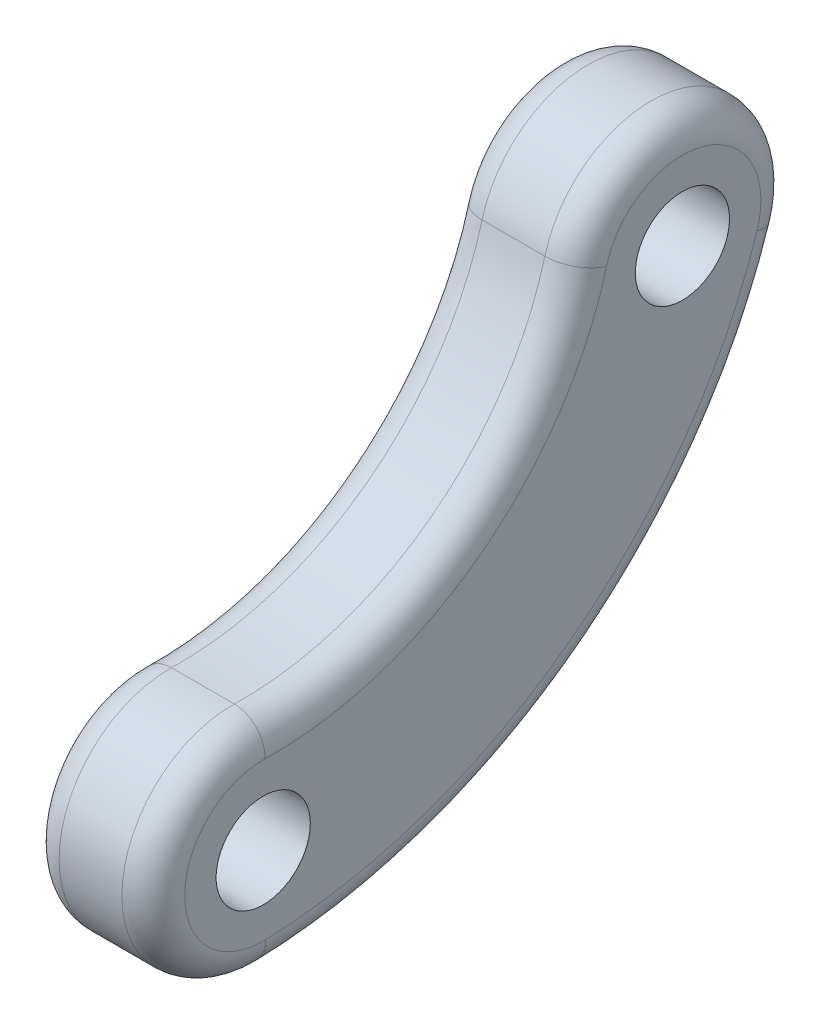
from build123d import *

# Parameters (mm, degrees)
SKETCH1_R           = 15
BOSS_EXTRUDE1_DEPTH = 40
FILLET1_R           = 10


with BuildPart() as part:
    # Sketch1 → Boss-Extrude1 (new body)
    with BuildSketch(Plane(origin=(0, 0, 0), x_dir=(0, 0, -1), z_dir=(1, 0, 0))):
        with BuildLine():
            ThreePointArc((33.277008782, -10.846229138), (9.959027872, 33.553207952), (-33.805757942, 9.064807223))
            ThreePointArc((-33.805757942, 9.064807223), (-70.44161018, -45.071700409), (-132.694646831, -65.009266851))
            ThreePointArc((-132.694646831, -65.009266851), (-168.499781041, -100.12380247), (-132.447129149, -134.984160172))
            ThreePointArc((-132.447129149, -134.984160172), (-29.948243855, -99.130344454), (33.277008782, -10.846229138))
        make_face()
        Circle(SKETCH1_R, mode=Mode.SUBTRACT)
        with Locations((-133.5, -100)):
            Circle(SKETCH1_R, mode=Mode.SUBTRACT)
    extrude(amount=BOSS_EXTRUDE1_DEPTH)

    # Fillet1
    fillet1_edges = [part.edges().sort_by_distance(p)[0] for p in [
        (40, -45.071700409, 70.44161018),
        (40, -100.12380247, 168.499781041),
        (40, -99.130344454, 29.948243855),
        (0, -100.12380247, 168.499781041),
        (0, -45.071700409, 70.44161018),
        (0, 33.553207952, -9.959027872),
        (0, -99.130344454, 29.948243855),
        (40, 33.553207952, -9.959027872),
    ]]
    fillet(fillet1_edges, radius=FILLET1_R)


solid = part.part
